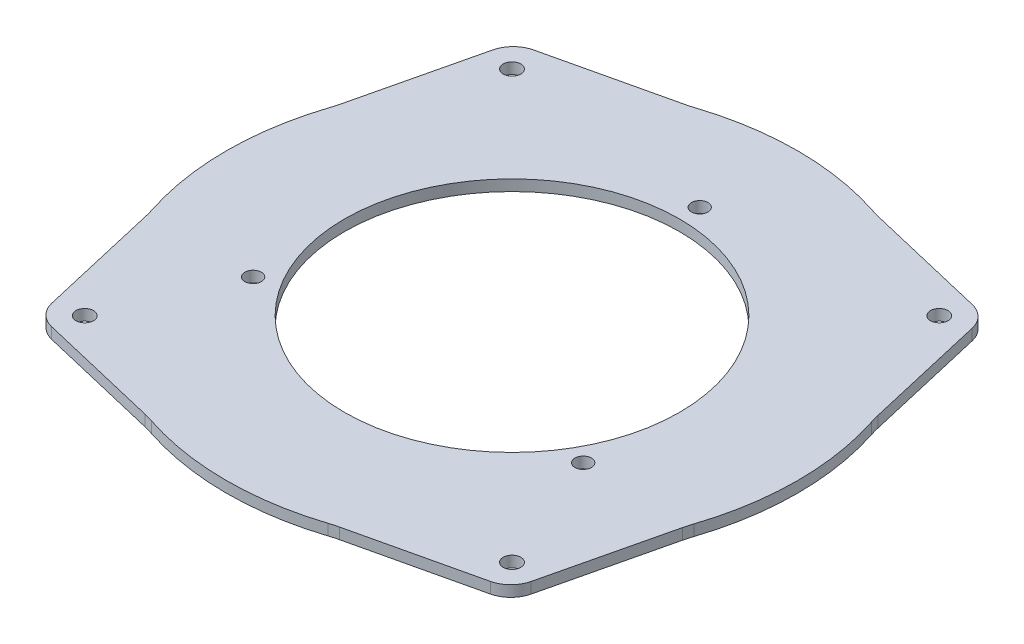
from build123d import *

# Parameters (mm, degrees)
SKETCH1_R           = 1.6
SKETCH1_R_2         = 30.5
SKETCH1_R_3         = 1.5
BOSS_EXTRUDE1_DEPTH = 2


with BuildPart() as part:
    # Sketch1 → Boss-Extrude1 (new body)
    with BuildSketch(Plane(origin=(0, 0, 0), x_dir=(1, 0, 0), z_dir=(0, 1, 0))):
        with BuildLine():
            Line((17.897079586, 48.929734976), (40.149284407, 43.651218265))
            ThreePointArc((40.149284407, 43.651218265), (42.540265174, 42.312242187), (43.866371506, 39.91409958))
            Line((43.866371506, 39.91409958), (49.02521675, 17.633846579))
            ThreePointArc((49.02521675, 17.633846579), (49.23478351, 16.809026698), (49.479249782, 15.993868858))
            ThreePointArc((49.479249782, 15.993868858), (51.999812242, -0.139738387), (49.392575566, -16.259565766))
            ThreePointArc((49.392575566, -16.259565766), (49.143731732, -17.073397941), (48.929734976, -17.897079586))
            Line((48.929734976, -17.897079586), (43.651218265, -40.149284407))
            ThreePointArc((43.651218265, -40.149284407), (42.312242187, -42.540265174), (39.91409958, -43.866371506))
            Line((39.91409958, -43.866371506), (17.633846579, -49.02521675))
            ThreePointArc((17.633846579, -49.02521675), (16.809026698, -49.23478351), (15.993868858, -49.479249782))
            ThreePointArc((15.993868858, -49.479249782), (-0.139738387, -51.999812242), (-16.259565766, -49.392575566))
            ThreePointArc((-16.259565766, -49.392575566), (-17.073397941, -49.143731732), (-17.897079586, -48.929734976))
            Line((-17.897079586, -48.929734976), (-40.149284407, -43.651218265))
            ThreePointArc((-40.149284407, -43.651218265), (-42.540265174, -42.312242187), (-43.866371506, -39.91409958))
            Line((-43.866371506, -39.91409958), (-49.02521675, -17.633846579))
            ThreePointArc((-49.02521675, -17.633846579), (-49.23478351, -16.809026698), (-49.479249782, -15.993868858))
            ThreePointArc((-49.479249782, -15.993868858), (-51.999812242, 0.139738387), (-49.392575566, 16.259565766))
            ThreePointArc((-49.392575566, 16.259565766), (-49.143731732, 17.073397941), (-48.929734976, 17.897079586))
            Line((-48.929734976, 17.897079586), (-43.651218265, 40.149284407))
            ThreePointArc((-43.651218265, 40.149284407), (-42.312242187, 42.540265174), (-39.91409958, 43.866371506))
            Line((-39.91409958, 43.866371506), (-17.633846579, 49.02521675))
            ThreePointArc((-17.633846579, 49.02521675), (-16.809026698, 49.23478351), (-15.993868858, 49.479249782))
            ThreePointArc((-15.993868858, 49.479249782), (-8.026622704, 51.3767781), (0.139738387, 51.999812242))
            ThreePointArc((0.139738387, 51.999812242), (8.302633013, 51.332896714), (16.259565766, 49.392575566))
            ThreePointArc((16.259565766, 49.392575566), (17.073397941, 49.143731732), (17.897079586, 48.929734976))
        make_face()
        with Locations(Location((-38.8907, 38.8907, 0), (0, 0, 270))):
            Circle(SKETCH1_R, mode=Mode.SUBTRACT)
        with Locations(Location((38.8907, 38.8907, 0), (0, 0, 90))):
            Circle(SKETCH1_R, mode=Mode.SUBTRACT)
        with Locations(Location((38.8907, -38.8907, 0), (0, 0, 270))):
            Circle(SKETCH1_R, mode=Mode.SUBTRACT)
        with Locations(Location((-38.8907, -38.8907, 0), (0, 0, 90))):
            Circle(SKETCH1_R, mode=Mode.SUBTRACT)
        with Locations(Location((0, 0, 0), (0, 0, 270))):
            Circle(SKETCH1_R_2, mode=Mode.SUBTRACT)
        with Locations(Location((0, 34.1739971, 0), (0, 0, 270))):
            Circle(SKETCH1_R_3, mode=Mode.SUBTRACT)
        with Locations(Location((-29.672696408, -17.456745562, 0), (0, 0, 270))):
            Circle(SKETCH1_R_3, mode=Mode.SUBTRACT)
        with Locations(Location((29.672696408, -16.717251537, 0), (0, 0, 270))):
            Circle(SKETCH1_R_3, mode=Mode.SUBTRACT)
    extrude(amount=BOSS_EXTRUDE1_DEPTH)


solid = part.part
